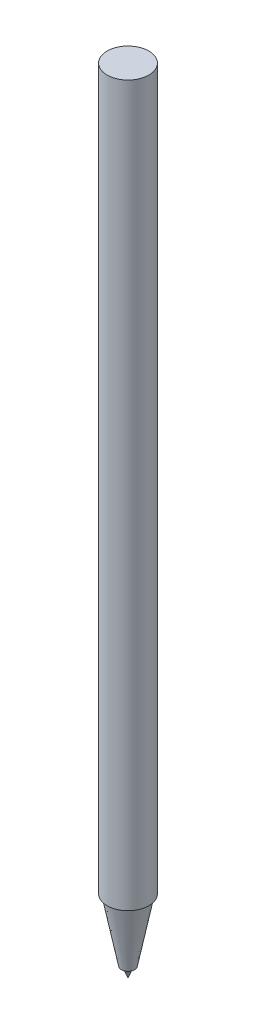
from build123d import *

# Parameters (mm, degrees)
SKETCH1_R           = 4
BOSS_EXTRUDE1_DEPTH = 138
SKETCH2_R           = 3.6
BOSS_EXTRUDE2_DEPTH = 12
BOSS_EXTRUDE2_TAPER = 11


with BuildPart() as part:
    # Sketch1 → Boss-Extrude1 (new body)
    with BuildSketch(Plane(origin=(0, 0, 0), x_dir=(1, 0, 0), z_dir=(0, 1, 0))):
        with Locations(Location((0, 0, 0), (0, 0, 270))):
            Circle(SKETCH1_R)
    extrude(amount=BOSS_EXTRUDE1_DEPTH)

    # Sketch2 → Boss-Extrude2 (add)
    with BuildSketch(Plane.XZ):
        Circle(SKETCH2_R)
    extrude(amount=BOSS_EXTRUDE2_DEPTH, taper=BOSS_EXTRUDE2_TAPER)

    # Boss-Extrude3 cone 1 section (through the dimple's axis) → Boss-Extrude3 (revolve)
    with BuildSketch(Plane(origin=(0, -12, 0), x_dir=(0, 0, 1), z_dir=(1, 0, 0))):
        Polygon((0, 0), (0.76743629, 0), (0, 1.999239888), align=None)
    revolve(axis=Axis((0, -12, 0), (0, -1, 0)))


solid = part.part
